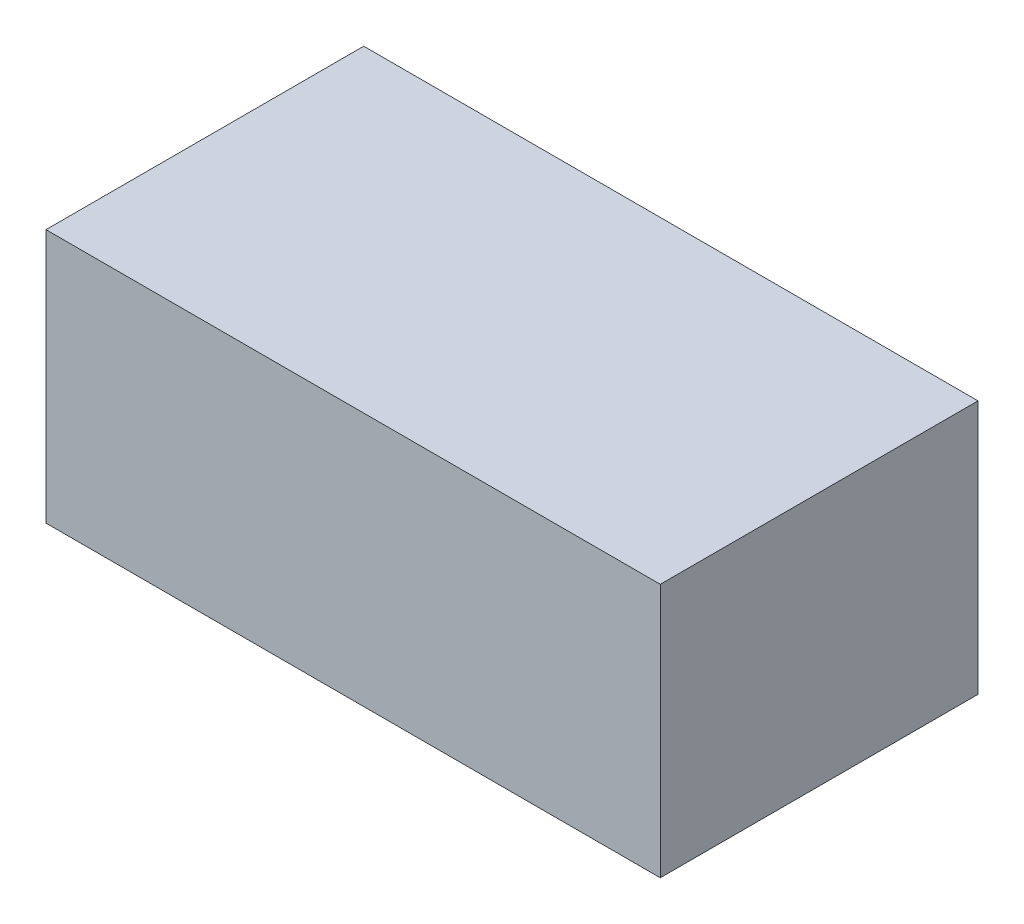
from build123d import *

# Parameters (mm, degrees)
SKETCH_1_W      = 58
SKETCH_1_H      = 30
EXTRUDE_1_DEPTH = 24


with BuildPart() as part:
    # 草图1 → 凸台-拉伸1 (new body)
    with BuildSketch(Plane(origin=(0, 0, 0), x_dir=(1, 0, 0), z_dir=(0, 1, 0))):
        Rectangle(SKETCH_1_W, SKETCH_1_H)
    extrude(amount=EXTRUDE_1_DEPTH)


solid = part.part
